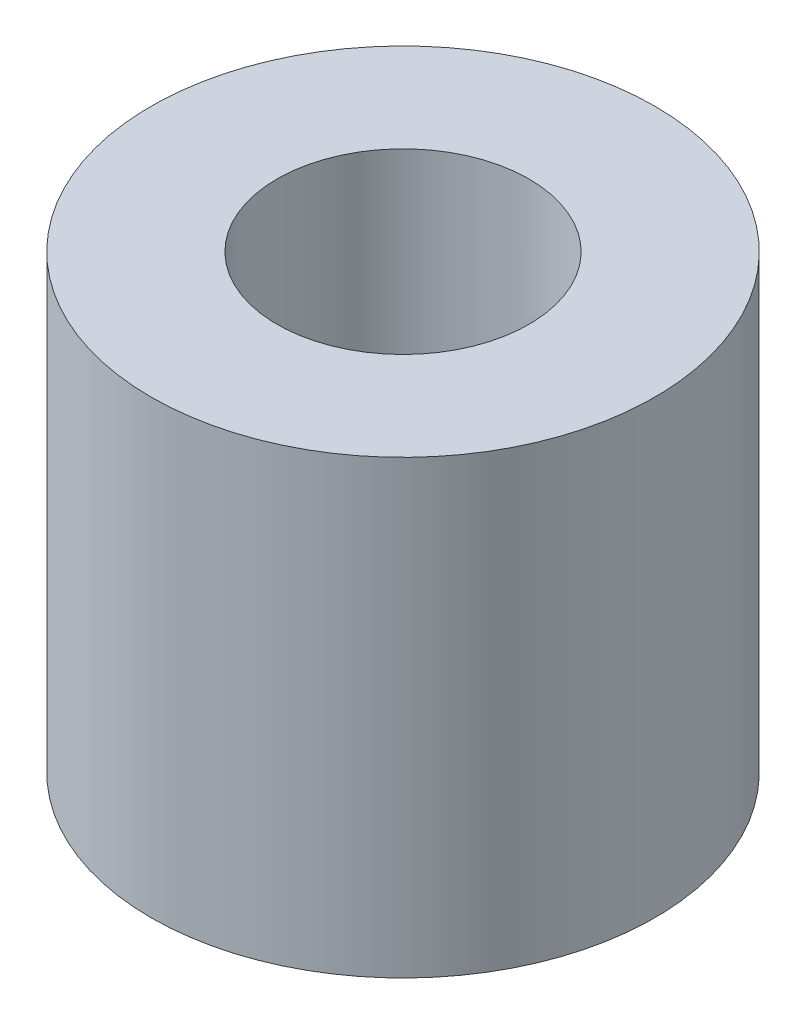
from build123d import *

# Parameters (mm, degrees)
EXTRUDE_START   = 103.721566
SKETCH_1_R      = 7
SKETCH_1_R_2    = 3.5
EXTRUDE_1_DEPTH = 12.530000014


with BuildPart() as part:
    # Эскиз1 → Вытянуть1 (new body)
    with BuildSketch(Plane(origin=(0, 0, 0), x_dir=(1, 0, 0), z_dir=(0, 1, 0)).offset(EXTRUDE_START)):
        with Locations(Location((0, 0, 0), (0, 0, 270))):
            Circle(SKETCH_1_R)
        with Locations(Location((0, 0, 0), (0, 0, 161.289830395))):
            Circle(SKETCH_1_R_2, mode=Mode.SUBTRACT)
    extrude(amount=EXTRUDE_1_DEPTH)


solid = part.part
